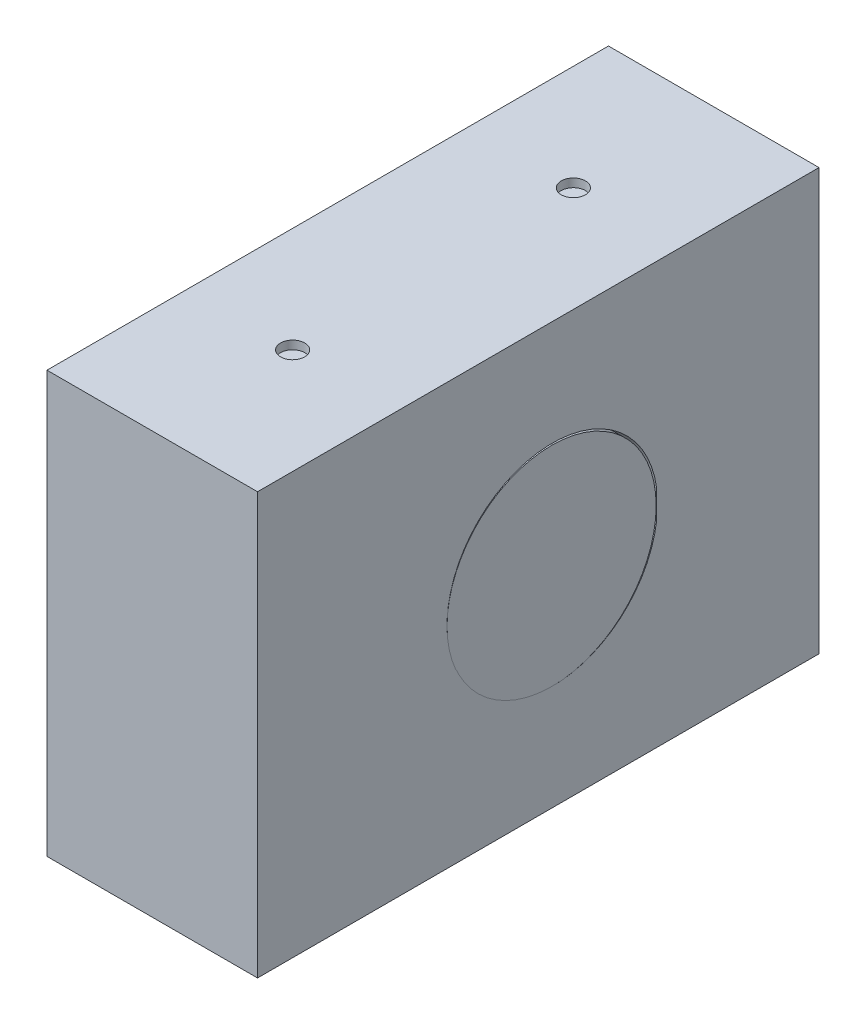
from build123d import *

# Parameters (mm, degrees)
BOSS_EXTRUDE1_DEPTH               = 19.05
F_1_4_20_TAPPED_HOLE1_D           = 5.1054
F_1_4_20_TAPPED_HOLE1_DEPTH       = 16.51
F_1_4_20_TAPPED_HOLE1_CSINK_D     = 6.3754
F_1_4_20_TAPPED_HOLE1_CSINK_ANGLE = 90
F_1_4_20_TAPPED_HOLE1_TIP         = 1.533816902
SKETCH10_R                        = 9.459955788
BOSS_EXTRUDE2_DEPTH               = 19.05
SKETCH11_W                        = 14.690046345
SKETCH11_H                        = 2.54
BOSS_EXTRUDE3_DEPTH               = 19.05
SKETCH8_R                         = 1.0922
CUT_EXTRUDE4_DEPTH                = 0.762


with BuildPart() as part:
    # Sketch2 → Boss-Extrude1 (new body)
    with BuildSketch(Plane(origin=(0, 0, 0), x_dir=(0, 0, -1), z_dir=(1, 0, 0))):
        with BuildLine():
            Line((0, 0), (50.8, 0))
            Line((50.8, 0), (50.8, 17.78))
            Line((50.8, 17.78), (36.109953655, 17.78))
            ThreePointArc((36.109953655, 17.78), (17.145, 19.05), (36.109953655, 20.32))
            Line((36.109953655, 20.32), (50.8, 20.32))
            Line((50.8, 20.32), (50.8, 38.1))
            Line((50.8, 38.1), (0, 38.1))
            Line((0, 38.1), (0, 0))
        make_face()
    extrude(amount=BOSS_EXTRUDE1_DEPTH)

    # 1/4-20 Tapped Hole1
    with Locations(Plane(origin=(0, 0, 0), x_dir=(-1, 0, 0), z_dir=(0, -1, 0))):
        with Locations((-9.525, 12.7), (-9.525, 38.1)):
            CounterSinkHole(F_1_4_20_TAPPED_HOLE1_D / 2, F_1_4_20_TAPPED_HOLE1_CSINK_D / 2, depth=F_1_4_20_TAPPED_HOLE1_DEPTH, counter_sink_angle=F_1_4_20_TAPPED_HOLE1_CSINK_ANGLE)
            with Locations((0, 0, -(F_1_4_20_TAPPED_HOLE1_DEPTH + F_1_4_20_TAPPED_HOLE1_TIP / 2))):  # 118° drill point
                Cone(0, F_1_4_20_TAPPED_HOLE1_D / 2, F_1_4_20_TAPPED_HOLE1_TIP, mode=Mode.SUBTRACT)

    # Sketch11 → Boss-Extrude3 (add)
    with BuildSketch(Plane.ZY):
        with Locations((-43.454976828, 19.05)):
            Rectangle(SKETCH11_W, SKETCH11_H)
    extrude(amount=-BOSS_EXTRUDE3_DEPTH)

    # Sketch8 → Cut-Extrude4 (cut)
    with BuildSketch(Plane(origin=(0, 38.1, 0), x_dir=(1, 0, 0), z_dir=(0, 1, 0))):
        with Locations((9.525, 12.7)):
            Circle(SKETCH8_R)
        with Locations((9.525, 38.1)):
            Circle(SKETCH8_R)
    extrude(amount=-CUT_EXTRUDE4_DEPTH, mode=Mode.SUBTRACT)


with BuildPart() as body_2:
    # Sketch10 → Boss-Extrude2 (new body)
    with BuildSketch(Plane(origin=(0, -2.659795234, 0), x_dir=(0, 0, 1), z_dir=(-1, 0, 0))):
        with Locations((-26.60495728, 21.63538199)):
            Circle(SKETCH10_R)
    extrude(amount=-BOSS_EXTRUDE2_DEPTH)


solid = Compound([part.part, body_2.part])
